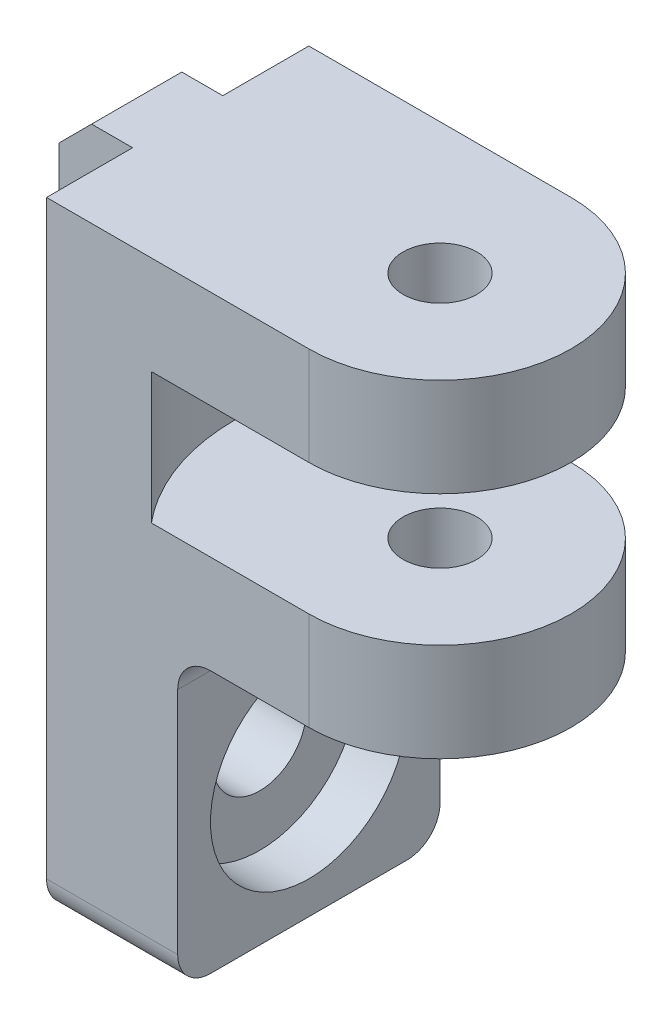
from build123d import *

# Parameters (mm, degrees)
SKETCH1_W           = 16
SKETCH1_H           = 38
BOSS_EXTRUDE1_DEPTH = 8
SKETCH2_W           = 5.5
SKETCH2_H           = 22
BOSS_EXTRUDE2_DEPTH = 4.5
SKETCH6_R           = 2.25
BOSS_EXTRUDE3_DEPTH = 20
FILLET6_R           = 2
CHAMFER1_SIZE       = 2
SKETCH7_R           = 2.85
CUT_EXTRUDE1_DEPTH  = 10
SKETCH8_R           = 6
CUT_EXTRUDE2_DEPTH  = 3
CUT_EXTRUDE3_START  = -10
SKETCH9_R           = 12.5
CUT_EXTRUDE3_DEPTH  = 4
FILLET7_R           = 2


with BuildPart() as part:
    # Sketch1 → Boss-Extrude1 (new body)
    with BuildSketch(Plane(origin=(0, 0, 0), x_dir=(0, 0, -1), z_dir=(1, 0, 0))):
        with Locations((-40.846556001, 16.91146402)):
            Rectangle(SKETCH1_W, SKETCH1_H)
    extrude(amount=BOSS_EXTRUDE1_DEPTH)

    # Sketch2 → Boss-Extrude2 (add)
    with BuildSketch(Plane.ZY):
        with Locations((40.846556001, 24.91146402)):
            Rectangle(SKETCH2_W, SKETCH2_H)
    extrude(amount=BOSS_EXTRUDE2_DEPTH)

    # Sketch6 → Boss-Extrude3 (add)
    with BuildSketch(Plane.XZ.offset(-35.91146402)):
        with BuildLine():
            Line((8, 48.846556001), (16, 48.846556001))
            ThreePointArc((16, 48.846556001), (24, 40.846556001), (16, 32.846556001))
            Line((16, 32.846556001), (8, 32.846556001))
            Line((8, 32.846556001), (8, 48.846556001))
        make_face()
        with Locations(Location((16, 40.846556001, 0), (0, 0, 270))):
            Circle(SKETCH6_R, mode=Mode.SUBTRACT)
    extrude(amount=BOSS_EXTRUDE3_DEPTH)

    # Fillet6
    fillet6_edges = [part.edges().sort_by_distance(p)[0] for p in [
        (8, 15.91146402, 40.846556001),
    ]]
    fillet(fillet6_edges, radius=FILLET6_R)

    # Chamfer1
    chamfer1_edges = [part.edges().sort_by_distance(p)[0] for p in [
        (-4.5, 13.91146402, 40.846556001),
        (-4.5, 35.91146402, 40.846556001),
    ]]
    chamfer(chamfer1_edges, length=CHAMFER1_SIZE)

    # Sketch7 → Cut-Extrude1 (cut)
    with BuildSketch(Plane(origin=(8, 0, 0), x_dir=(0, 0, -1), z_dir=(1, 0, 0))):
        with Locations((-40.846556001, 5.91146402)):
            Circle(SKETCH7_R)
    extrude(amount=-CUT_EXTRUDE1_DEPTH, mode=Mode.SUBTRACT)

    # Sketch8 → Cut-Extrude2 (cut)
    with BuildSketch(Plane(origin=(8, 0, 0), x_dir=(0, 0, -1), z_dir=(1, 0, 0))):
        with Locations((-40.846556001, 5.91146402)):
            Circle(SKETCH8_R)
    extrude(amount=-CUT_EXTRUDE2_DEPTH, mode=Mode.SUBTRACT)

    # Sketch9 → Cut-Extrude3 (cut, symmetric)
    with BuildSketch(Plane(origin=(0, 35.91146402, 0), x_dir=(1, 0, 0), z_dir=(0, 1, 0)).offset(CUT_EXTRUDE3_START)):
        with Locations((16, -40.846556001)):
            Circle(SKETCH9_R)
    extrude(amount=CUT_EXTRUDE3_DEPTH, both=True, mode=Mode.SUBTRACT)

    # Fillet7
    fillet7_edges = [part.edges().sort_by_distance(p)[0] for p in [
        (4, -2.08853598, 32.846556001),
        (4, -2.08853598, 48.846556001),
    ]]
    fillet(fillet7_edges, radius=FILLET7_R)


solid = part.part
